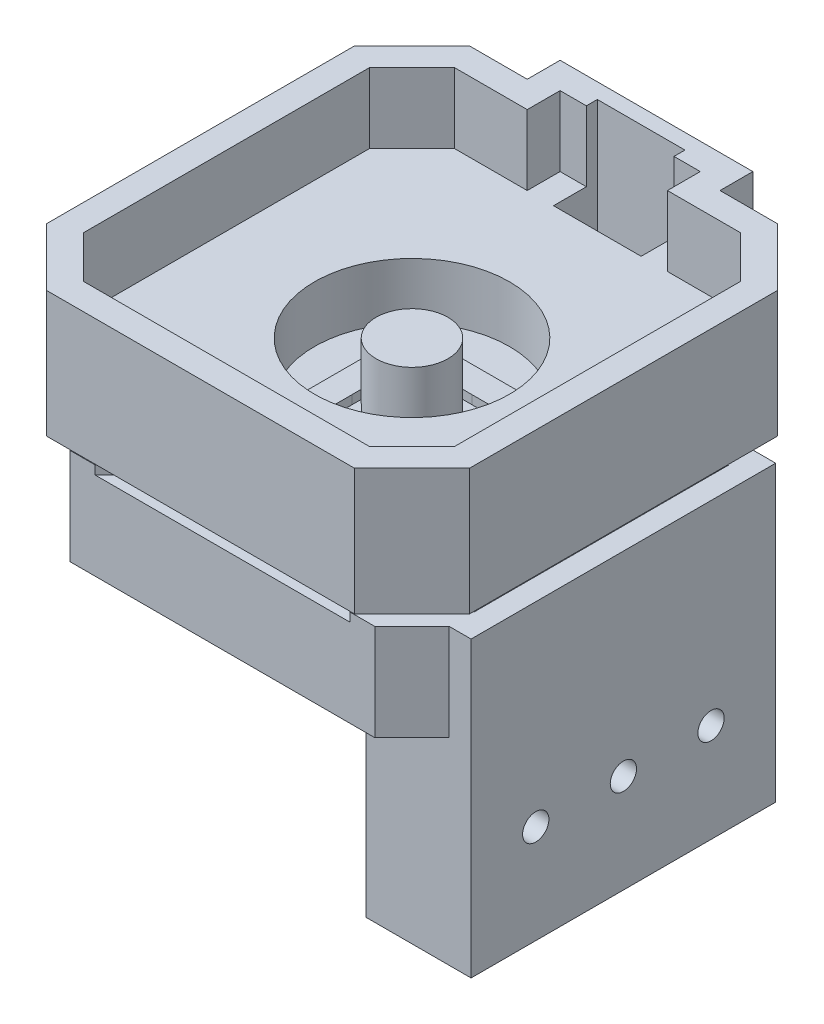
from build123d import *

# Parameters (mm, degrees)
BOSS_EXTRUDE1_DEPTH      = 8
BOSS_EXTRUDE2_DEPTH      = 6.4
SKETCH4_R                = 11.125
CUT_EXTRUDE1_DEPTH       = 13
SKETCH5_R                = 4.1
BOSS_EXTRUDE3_DEPTH      = 13
SKETCH6_R                = 1.5
BOSS_EXTRUDE4_DEPTH      = 4
CIRPATTERN2_COUNT        = 4
SKETCH8_W                = 10
SKETCH8_H                = 5
CUT_EXTRUDE2_DEPTH       = 19
BOSS_EXTRUDE5_DEPTH      = 7
BOSS_EXTRUDE5_DEPTH_BACK = 3
SKETCH10_W               = 34.760105104
SKETCH10_H               = 11
BOSS_EXTRUDE6_DEPTH      = 2.5
SKETCH11_W               = 12
SKETCH11_H               = 34.760105104
BOSS_EXTRUDE7_DEPTH      = 22.5
CUT_EXTRUDE3_DEPTH       = 22.5


with BuildPart() as part:
    # Sketch1 → Boss-Extrude1 (new body)
    with BuildSketch(Plane.XZ.offset(-16.312689454)):
        Polygon((-42.346407377, 51.389271206), (-42.346407377, 16.250671026), (-35.765707467, 9.669971116), (-29.196407377, 9.669971116), (-29.196407377, 5.919971116), (-7.196407377, 5.919971116), (-7.196407377, 9.669971116), (-0.627107287, 9.669971116), (5.953592623, 16.250671026), (5.953592623, 51.389271206), (-0.627107287, 57.969971116), (-35.765707467, 57.969971116), align=None)
        Polygon((-10.196407377, 12.669971116), (-1.869747974, 12.669971116), (2.953592623, 17.493311713), (2.953592623, 50.146630519), (-1.869747974, 54.969971116), (-34.52306678, 54.969971116), (-39.346407377, 50.146630519), (-39.346407377, 17.493311713), (-34.52306678, 12.669971116), (-26.196407377, 12.669971116), (-26.196407377, 8.919971116), (-10.196407377, 8.919971116), align=None, mode=Mode.SUBTRACT)
    extrude(amount=-BOSS_EXTRUDE1_DEPTH)

    # Sketch3 → Boss-Extrude2 (add)
    with BuildSketch(Plane.XZ.offset(-16.312689454)):
        Polygon((-35.765707467, 57.969971116), (-42.346407377, 51.389271206), (-42.346407377, 16.250671026), (-35.765707467, 9.669971116), (-29.196407377, 9.669971116), (-29.196407377, 5.919971116), (-7.196407377, 5.919971116), (-7.196407377, 9.669971116), (-0.627107287, 9.669971116), (5.953592623, 16.250671026), (5.953592623, 51.389271206), (-0.627107287, 57.969971116), align=None)
    extrude(amount=BOSS_EXTRUDE2_DEPTH)

    # Sketch4 → Cut-Extrude1 (cut)
    with BuildSketch(Plane.XZ.offset(-9.912689454)):
        with Locations(Location((-18.196407377, 33.819971116, 0), (0, 0, 270))):
            Circle(SKETCH4_R)
    extrude(amount=-CUT_EXTRUDE1_DEPTH, mode=Mode.SUBTRACT)

    # Sketch8 → Cut-Extrude2 (cut)
    with BuildSketch(Plane(origin=(0, 24.312689454, 0), x_dir=(1, 0, 0), z_dir=(0, 1, 0))):
        with Locations((-18.196407377, -10.169971116)):
            Rectangle(SKETCH8_W, SKETCH8_H)
    extrude(amount=-CUT_EXTRUDE2_DEPTH, mode=Mode.SUBTRACT)


with BuildPart() as body_2:
    # Sketch5 → Boss-Extrude3 (new body)
    with BuildSketch(Plane.XZ.offset(-16.312689454)):
        with Locations(Location((-18.196407377, 33.819971116, 0), (0, 0, 270))):
            Circle(SKETCH5_R)
    extrude(amount=BOSS_EXTRUDE3_DEPTH)

    # Sketch6 → Boss-Extrude4 (add)
    with BuildSketch(Plane.XZ.offset(-3.312689454)):
        with BuildLine():
            Line((-22.141431086, 34.9365677), (-25.022114558, 37.817251172))
            Line((-25.022114558, 37.817251172), (-25.022114558, 33.819971116))
            Line((-25.022114558, 33.819971116), (-28.024834502, 33.819971116))
            Line((-28.024834502, 33.819971116), (-28.024834502, 40.819971116))
            Line((-28.024834502, 40.819971116), (-33.455139585, 46.250276199))
            Line((-33.455139585, 46.250276199), (-34.162246366, 45.543169418))
            Line((-34.162246366, 45.543169418), (-36.990673491, 45.543169418))
            Line((-36.990673491, 45.543169418), (-39.819100616, 48.371596543))
            Line((-39.819100616, 48.371596543), (-39.819100616, 51.200023668))
            Line((-39.819100616, 51.200023668), (-35.576459929, 55.442664355))
            Line((-35.576459929, 55.442664355), (-32.748032804, 55.442664355))
            Line((-32.748032804, 55.442664355), (-29.919605679, 52.61423723))
            Line((-29.919605679, 52.61423723), (-29.919605679, 49.785810105))
            Line((-29.919605679, 49.785810105), (-30.626712461, 49.078703324))
            Line((-30.626712461, 49.078703324), (-25.196407377, 43.648398241))
            Line((-25.196407377, 43.648398241), (-18.196407377, 43.648398241))
            Line((-18.196407377, 43.648398241), (-18.196407377, 40.648398241))
            Line((-18.196407377, 40.648398241), (-22.196407377, 40.648398241))
            Line((-22.196407377, 40.648398241), (-19.313003962, 37.764994825))
            ThreePointArc((-19.313003962, 37.764994825), (-21.09554518, 36.719108919), (-22.141431086, 34.9365677))
        make_face()
        with Locations(Location((-34.869353148, 50.492916887, 0), (0, 0, 270))):
            Circle(SKETCH6_R, mode=Mode.SUBTRACT)
    boss_extrude4 = extrude(amount=-BOSS_EXTRUDE4_DEPTH)

    # CirPattern2: Boss-Extrude4 ×4 about axis
    cirpattern2_axis = Axis((-18.196407377, 0, 33.819971116), (0, 1, 0))
    for i in range(1, CIRPATTERN2_COUNT):
        add(boss_extrude4.rotate(cirpattern2_axis, i * 360 / CIRPATTERN2_COUNT))

    # Sketch9 → Boss-Extrude5 (add, two sides: drawn at the far end of the back side and taken through both)
    with BuildSketch(Plane.XZ.offset(-3.312689454).offset(-BOSS_EXTRUDE5_DEPTH_BACK)):
        Polygon((-32.748032804, 12.197277877), (-3.64478195, 12.197277877), (-0.816354825, 12.197277877), (3.426285862, 16.439918564), (3.426285862, 19.268345689), (3.426285862, 48.371596543), (3.426285862, 51.200023668), (-0.816354825, 55.442664355), (-3.64478195, 55.442664355), (-32.748032804, 55.442664355), (-35.576459929, 55.442664355), (-39.819100616, 51.200023668), (-39.819100616, 48.371596543), (-39.819100616, 19.268345689), (-39.819100616, 16.439918564), (-35.576459929, 12.197277877), align=None)
    extrude(amount=BOSS_EXTRUDE5_DEPTH + BOSS_EXTRUDE5_DEPTH_BACK)

    # Sketch10 → Boss-Extrude6 (add)
    with BuildSketch(Plane(origin=(3.426285862, 0, 0), x_dir=(0, 0, -1), z_dir=(1, 0, 0))):
        with Locations((-33.819971116, 1.812689454)):
            Rectangle(SKETCH10_W, SKETCH10_H)
    extrude(amount=BOSS_EXTRUDE6_DEPTH)

    # Sketch11 → Boss-Extrude7 (add)
    with BuildSketch(Plane.XZ.offset(3.687310546)):
        with Locations((-0.073714138, 33.819971116)):
            Rectangle(SKETCH11_W, SKETCH11_H)
    extrude(amount=BOSS_EXTRUDE7_DEPTH)

    # Sketch12 → Cut-Extrude3 (cut)
    with BuildSketch(Plane.ZY.offset(6.073714138)):
        with BuildLine():
            ThreePointArc((33.819971116, -13.437310546), (32.759310944, -13.876650374), (32.319971116, -14.937310546))
            Line((32.319971116, -14.937310546), (33.819971116, -14.937310546))
            Line((33.819971116, -14.937310546), (33.819971116, -13.437310546))
        make_face()
        with BuildLine():
            Line((33.819971116, -14.937310546), (32.319971116, -14.937310546))
            ThreePointArc((32.319971116, -14.937310546), (32.759310944, -15.997970718), (33.819971116, -16.437310546))
            Line((33.819971116, -16.437310546), (33.819971116, -14.937310546))
        make_face()
        with BuildLine():
            Line((33.819971116, -13.437310546), (33.819971116, -14.937310546))
            Line((33.819971116, -14.937310546), (35.319971116, -14.937310546))
            ThreePointArc((35.319971116, -14.937310546), (34.880631288, -13.876650374), (33.819971116, -13.437310546))
        make_face()
        with BuildLine():
            Line((35.319971116, -14.937310546), (33.819971116, -14.937310546))
            Line((33.819971116, -14.937310546), (33.819971116, -16.437310546))
            ThreePointArc((33.819971116, -16.437310546), (34.880631288, -15.997970718), (35.319971116, -14.937310546))
        make_face()
        with BuildLine():
            ThreePointArc((45.319971116, -14.937310546), (43.819971116, -13.437310546), (42.319971116, -14.937310546))
            Line((42.319971116, -14.937310546), (45.319971116, -14.937310546))
        make_face()
        with BuildLine():
            Line((45.319971116, -14.937310546), (42.319971116, -14.937310546))
            ThreePointArc((42.319971116, -14.937310546), (43.819971116, -16.437310546), (45.319971116, -14.937310546))
        make_face()
        with BuildLine():
            ThreePointArc((25.319971116, -14.937310546), (23.819971116, -13.437310546), (22.319971116, -14.937310546))
            Line((22.319971116, -14.937310546), (25.319971116, -14.937310546))
        make_face()
        with BuildLine():
            Line((25.319971116, -14.937310546), (22.319971116, -14.937310546))
            ThreePointArc((22.319971116, -14.937310546), (23.819971116, -16.437310546), (25.319971116, -14.937310546))
        make_face()
    extrude(amount=-CUT_EXTRUDE3_DEPTH, mode=Mode.SUBTRACT)


solid = Compound([part.part, body_2.part])
